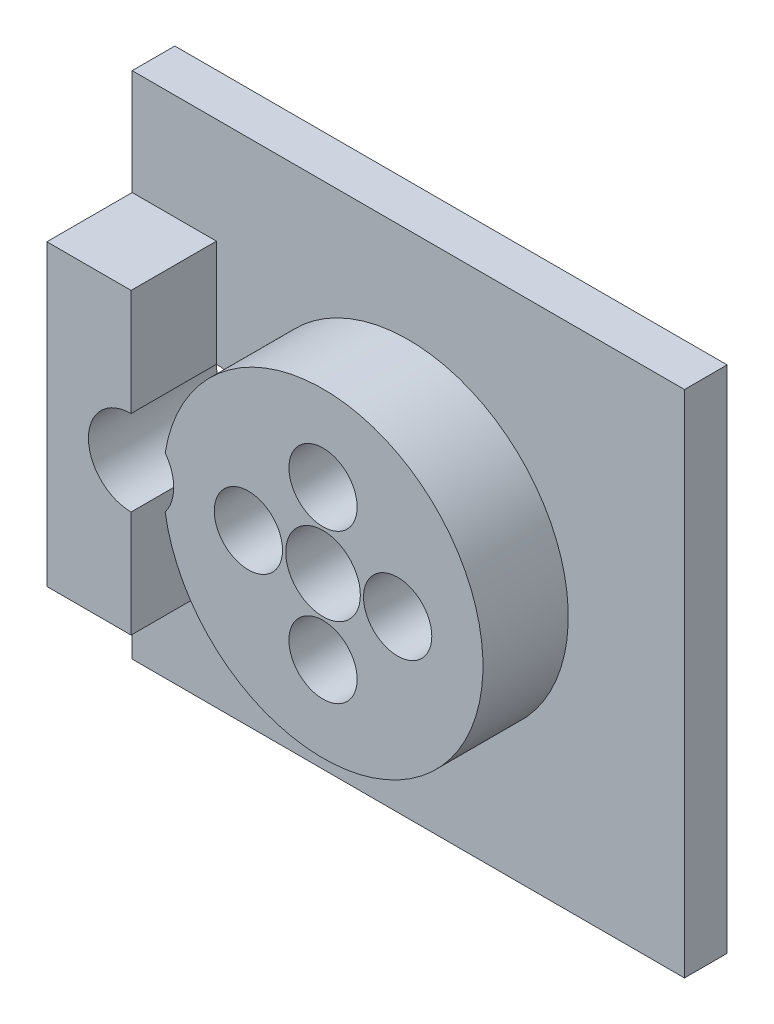
from build123d import *

# Parameters (mm, degrees)
S_BOX1_W      = 51.8
S_BOX1_H      = 47.8
BOSS_1_DEPTH  = 4
S_CYL2_R      = 15
BOSS_2_DEPTH  = 8.1
S_BOX3_W      = 7.9
S_BOX3_H      = 28
BOSS_3_DEPTH  = 8.1
S_HOLE4_R     = 4
HOLE_4_DEPTH  = 12.2
S_HOLE5_R     = 3.5
HOLE_5_DEPTH  = 12.2
S_HOLE6_R     = 1.7
HOLE_6_DEPTH  = 12.2
S_HOLE7_R     = 1.7
HOLE_7_DEPTH  = 12.2
S_HOLE8_R     = 1.7
HOLE_8_DEPTH  = 12.2
S_HOLE9_R     = 1.7
HOLE_9_DEPTH  = 12.2
S_HOLE10_R    = 3.2
HOLE_10_DEPTH = 7.1
S_HOLE11_R    = 3.2
HOLE_11_DEPTH = 7.1
S_HOLE12_R    = 3.2
HOLE_12_DEPTH = 7.1
S_HOLE13_R    = 3.2
HOLE_13_DEPTH = 7.1
S_HOLE14_R    = 0.9
HOLE_14_DEPTH = 6.1
S_HOLE15_R    = 0.9
HOLE_15_DEPTH = 6.1


with BuildPart() as part:
    # S_box1 → Boss_1 (new body)
    with BuildSketch(Plane.XY):
        Rectangle(S_BOX1_W, S_BOX1_H)
    extrude(amount=BOSS_1_DEPTH)

    # S_cyl2 → Boss_2 (add)
    with BuildSketch(Plane.XY.offset(3.9)):
        Circle(S_CYL2_R)
    extrude(amount=BOSS_2_DEPTH)

    # S_box3 → Boss_3 (add)
    with BuildSketch(Plane.XY.offset(3.9)):
        with Locations((-21.95, 0)):
            Rectangle(S_BOX3_W, S_BOX3_H)
    extrude(amount=BOSS_3_DEPTH)

    # S_hole4 → Hole_4 (cut)
    with BuildSketch(Plane.XY.offset(-0.1)):
        with Locations(Location((-18, 0, 0), (0, 0, 270))):
            Circle(S_HOLE4_R)
    extrude(amount=HOLE_4_DEPTH, mode=Mode.SUBTRACT)

    # S_hole5 → Hole_5 (cut)
    with BuildSketch(Plane.XY.offset(-0.1)):
        Circle(S_HOLE5_R)
    extrude(amount=HOLE_5_DEPTH, mode=Mode.SUBTRACT)

    # S_hole6 → Hole_6 (cut)
    with BuildSketch(Plane.XY.offset(-0.1)):
        with Locations((7, 0)):
            Circle(S_HOLE6_R)
    extrude(amount=HOLE_6_DEPTH, mode=Mode.SUBTRACT)

    # S_hole7 → Hole_7 (cut)
    with BuildSketch(Plane.XY.offset(-0.1)):
        with Locations((0, 7)):
            Circle(S_HOLE7_R)
    extrude(amount=HOLE_7_DEPTH, mode=Mode.SUBTRACT)

    # S_hole8 → Hole_8 (cut)
    with BuildSketch(Plane.XY.offset(-0.1)):
        with Locations((-7, 0)):
            Circle(S_HOLE8_R)
    extrude(amount=HOLE_8_DEPTH, mode=Mode.SUBTRACT)

    # S_hole9 → Hole_9 (cut)
    with BuildSketch(Plane.XY.offset(-0.1)):
        with Locations((0, -7)):
            Circle(S_HOLE9_R)
    extrude(amount=HOLE_9_DEPTH, mode=Mode.SUBTRACT)

    # S_hole10 → Hole_10 (cut)
    with BuildSketch(Plane.XY.offset(5)):
        with Locations((7, 0)):
            Circle(S_HOLE10_R)
    extrude(amount=HOLE_10_DEPTH, mode=Mode.SUBTRACT)

    # S_hole11 → Hole_11 (cut)
    with BuildSketch(Plane.XY.offset(5)):
        with Locations((0, 7)):
            Circle(S_HOLE11_R)
    extrude(amount=HOLE_11_DEPTH, mode=Mode.SUBTRACT)

    # S_hole12 → Hole_12 (cut)
    with BuildSketch(Plane.XY.offset(5)):
        with Locations((-7, 0)):
            Circle(S_HOLE12_R)
    extrude(amount=HOLE_12_DEPTH, mode=Mode.SUBTRACT)

    # S_hole13 → Hole_13 (cut)
    with BuildSketch(Plane.XY.offset(5)):
        with Locations((0, -7)):
            Circle(S_HOLE13_R)
    extrude(amount=HOLE_13_DEPTH, mode=Mode.SUBTRACT)

    # S_hole14 → Hole_14 (cut)
    with BuildSketch(Plane(origin=(-26, 0, 0), x_dir=(0, 0, -1), z_dir=(1, 0, 0))):
        with Locations((-8, -10)):
            Circle(S_HOLE14_R)
    extrude(amount=HOLE_14_DEPTH, mode=Mode.SUBTRACT)

    # S_hole15 → Hole_15 (cut)
    with BuildSketch(Plane(origin=(-26, 0, 0), x_dir=(0, 0, -1), z_dir=(1, 0, 0))):
        with Locations((-8, 10)):
            Circle(S_HOLE15_R)
    extrude(amount=HOLE_15_DEPTH, mode=Mode.SUBTRACT)


solid = part.part
